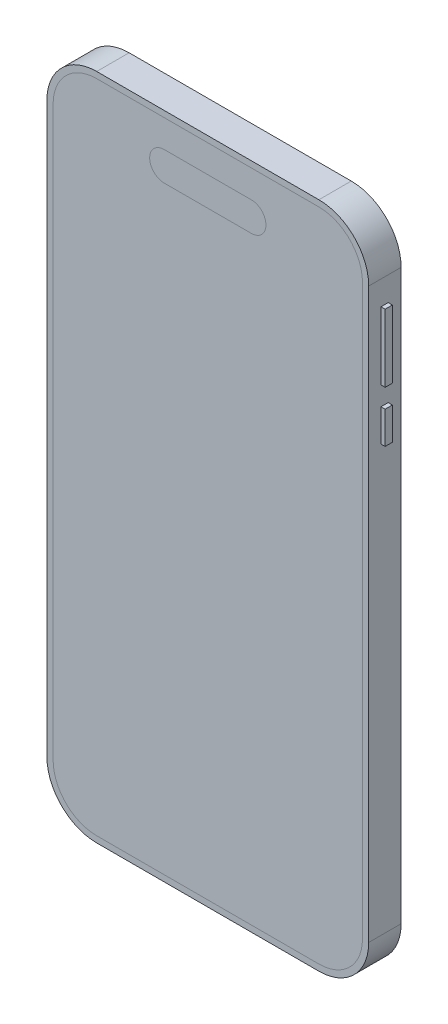
from build123d import *

# Parameters (mm, degrees)
EXTRUDE_1_DEPTH = 7.8
EXTRUDE_2_DEPTH = 1.2
SKETCH_15_4_R   = 7.5
EXTRUDE_3_DEPTH = 4
SKETCH_15_6_R   = 2
EXTRUDE_5_DEPTH = 2
SKETCH_19_W     = 1.732399473
SKETCH_19_H     = 16.304936216
SKETCH_19_H_2   = 7.781530809
EXTRUDE_6_DEPTH = 1
SKETCH_20_W     = 5.132835337
SKETCH_20_H     = 16.681714846
EXTRUDE_8_DEPTH = 1


with BuildPart() as part:
    # 草图1 → 凸台-拉伸1 (new body)
    with BuildSketch(Plane.XY):
        with BuildLine():
            Line((-26.75, -80.45), (26.75, -80.45))
            ThreePointArc((26.75, -80.45), (35.235281374, -76.935281374), (38.75, -68.45))
            Line((38.75, -68.45), (38.75, 68.45))
            ThreePointArc((38.75, 68.45), (35.235281374, 76.935281374), (26.75, 80.45))
            Line((26.75, 80.45), (-26.75, 80.45))
            ThreePointArc((-26.75, 80.45), (-35.235281374, 76.935281374), (-38.75, 68.45))
            Line((-38.75, 68.45), (-38.75, -68.45))
            ThreePointArc((-38.75, -68.45), (-35.235281374, -76.935281374), (-26.75, -80.45))
        make_face()
    extrude(amount=EXTRUDE_1_DEPTH)

    # 草图15 → 凸台-拉伸2 (add)
    with BuildSketch(Plane(origin=(0, 0, 0), x_dir=(-1, 0, 0), z_dir=(0, 0, -1))):
        with BuildLine():
            ThreePointArc((-35.75, 45.45), (-33.406854249, 39.793145751), (-27.75, 37.45))
            Line((-27.75, 37.45), (-5.75, 37.45))
            ThreePointArc((-5.75, 37.45), (-0.093145751, 39.793145751), (2.25, 45.45))
            Line((2.25, 45.45), (2.25, 67.45))
            ThreePointArc((2.25, 67.45), (-0.093145751, 73.106854249), (-5.75, 75.45))
            Line((-5.75, 75.45), (-27.75, 75.45))
            ThreePointArc((-27.75, 75.45), (-33.406854249, 73.106854249), (-35.75, 67.45))
            Line((-35.75, 67.45), (-35.75, 45.45))
        make_face()
    extrude(amount=EXTRUDE_2_DEPTH)

    # 草图15<4> → 凸台-拉伸3 (add)
    with BuildSketch(Plane(origin=(0, 0, 0), x_dir=(-1, 0, 0), z_dir=(0, 0, -1))):
        with Locations((-24.544228634, 65.45)):
            Circle(SKETCH_15_4_R)
        with Locations((-8.955771366, 56.45)):
            Circle(SKETCH_15_4_R)
        with Locations((-24.544228634, 47.45)):
            Circle(SKETCH_15_4_R)
    extrude(amount=EXTRUDE_3_DEPTH)

    # 草图15<6> → 凸台-拉伸5 (add)
    with BuildSketch(Plane(origin=(0, 0, 0), x_dir=(-1, 0, 0), z_dir=(0, 0, -1))):
        with Locations((-8.955771366, 68.45)):
            Circle(SKETCH_15_6_R)
    extrude(amount=EXTRUDE_5_DEPTH)

    # 草图19 → 凸台-拉伸6 (add)
    with BuildSketch(Plane(origin=(38.75, 0, 0), x_dir=(0, 0, -1), z_dir=(1, 0, 0))):
        with Locations((-3.974017222, 54.496659623)):
            Rectangle(SKETCH_19_W, SKETCH_19_H)
        with Locations((-3.974017222, 37.905227845)):
            Rectangle(SKETCH_19_W, SKETCH_19_H_2)
    extrude(amount=EXTRUDE_6_DEPTH)

    # 草图20 → 凸台-拉伸8 (add)
    with BuildSketch(Plane(origin=(38.75, 0, 0), x_dir=(0, 0, -1), z_dir=(1, 0, 0))):
        with Locations((-4.262343754, -17.460613504)):
            Rectangle(SKETCH_20_W, SKETCH_20_H)
    extrude(amount=-EXTRUDE_8_DEPTH)


solid = part.part
